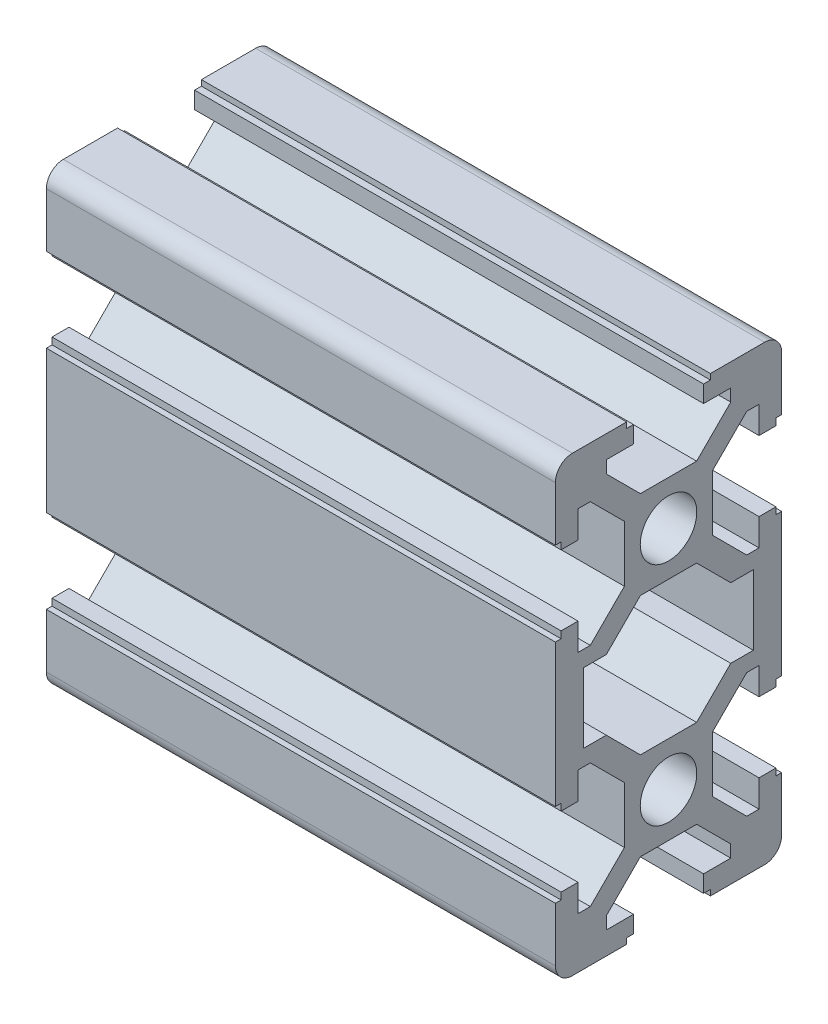
from build123d import *

# Parameters (mm, degrees)
SKETCH_1_W                = 1048
SKETCH_1_H                = 40
EXTRUDE_1_DEPTH           = 20
CUT_EXTRUDE_1_DEPTH       = 1049.239330799
CUT_EXTRUDE_2_REACH       = 1050.811
CUT_EXTRUDE_3_REACH       = 1050.239
CUT_EXTRUDE_3_END_RADIUS  = 5
SKETCH_4_W                = 0.605
SKETCH_4_H                = 0.5
CUT_EXTRUDE_4_DEPTH       = 1049.239330799
CUT_EXTRUDE_5_DEPTH       = 1049.737119623
CUT_EXTRUDE_6_REACH       = 1050.239
CUT_EXTRUDE_6_END_RADIUS  = 5
SKETCH_7_W                = 0.605
SKETCH_7_H                = 0.5
CUT_EXTRUDE_7_REACH       = 1050.811
CUT_EXTRUDE_8_REACH       = 1050.239
CUT_EXTRUDE_8_END_RADIUS  = 5
SKETCH_9_W                = 0.605
SKETCH_9_H                = 0.5
CUT_EXTRUDE_9_REACH       = 1050.239
CUT_EXTRUDE_9_END_RADIUS  = 5
SKETCH_10_W               = 0.605
SKETCH_10_H               = 0.5
CUT_EXTRUDE_10_DEPTH      = 1049.737119623
CUT_EXTRUDE_11_REACH      = 1050.239
CUT_EXTRUDE_11_END_RADIUS = 5
SKETCH_12_W               = 0.605
SKETCH_12_H               = 0.5
CUT_EXTRUDE_12_DEPTH      = 1049.239330799
CUT_EXTRUDE_13_DEPTH      = 1049.239330799
CUT_EXTRUDE_14_REACH      = 1050.239
CUT_EXTRUDE_14_END_RADIUS = 5
SKETCH_15_W               = 0.605
SKETCH_15_H               = 0.5
CUT_EXTRUDE_15_REACH      = 1050.239
CUT_EXTRUDE_15_END_RADIUS = 5
SKETCH_16_W               = 0.605
SKETCH_16_H               = 0.5
CUT_EXTRUDE_16_DEPTH      = 1049.239330799
CUT_EXTRUDE_17_DEPTH      = 1049.239330799
CUT_EXTRUDE_18_REACH      = 1050.239
CUT_EXTRUDE_18_END_RADIUS = 5
SKETCH_19_W               = 0.605
SKETCH_19_H               = 0.5
CUT_EXTRUDE_19_DEPTH      = 1049.239330799
DRAFT_1_ANGLE             = 45
DRAFT_2_ANGLE             = 45
SKETCH_21_W               = 5
SKETCH_21_H               = 5.49122085
SKETCH_22_W               = 5
SKETCH_22_H               = 5.49864809
HOLE_WIZARD_5_0_5_1_D     = 4.999999999
HOLE_WIZARD_5_0_5_2_D     = 4.999999999
FILLET_1_R                = 1.5
SKETCH_27_W               = 25
SKETCH_27_H               = 45
CUT_EXTRUDE_21_DEPTH      = 501.5
CUT_EXTRUDE_START         = -1048
SKETCH_28_W               = 25
SKETCH_28_H               = 45
CUT_EXTRUDE_22_DEPTH      = 501.5


with BuildPart() as part:
    # 草图1 → 凸台-拉伸1 (new body)
    with BuildSketch(Plane.XY.offset(9.92299271)):
        with Locations((-524, -0.00371362)):
            Rectangle(SKETCH_1_W, SKETCH_1_H)
    extrude(amount=-EXTRUDE_1_DEPTH)

    # 草图2 → 切除-拉伸1 (cut, through all)
    with BuildSketch(Plane(origin=(0, 0, 0), x_dir=(0, 0, -1), z_dir=(1, 0, 0))):
        Polygon((-3.02299271, 19.99628638), (-3.02299271, 17.99628638), (-5.42299271, 17.99628638), (-5.42299271, 16.91049994), (-2.40877915, 13.89628638), (2.56279373, 13.89628638), (5.57700729, 16.91049994), (5.57700729, 17.99628638), (3.17700729, 17.99628638), (3.17700729, 19.99628638), align=None)
    extrude(amount=-CUT_EXTRUDE_1_DEPTH, mode=Mode.SUBTRACT)

    # 草图3 → 切除-拉伸2 (cut, up to next)
    with BuildSketch(Plane(origin=(0, 19.99628638, 0), x_dir=(-1, 0, 0), z_dir=(0, 1, 0)), mode=Mode.PRIVATE) as cut_extrude_2_sk1:
        with BuildLine():
            Line((9.017348236, 3.02299271), (16.982651764, 3.02299271))
            ThreePointArc((16.982651764, 3.02299271), (13, 5), (9.017348236, 3.02299271))
        make_face()
    cut_extrude_2_tool1 = extrude(cut_extrude_2_sk1.sketch, amount=-CUT_EXTRUDE_2_REACH, mode=Mode.PRIVATE) & part.part
    add(cut_extrude_2_tool1.solids().sort_by_distance((-13, 19.996286, 3.828944))[0], mode=Mode.SUBTRACT)

    # 切除-拉伸3: up to this cylinder (the profile starts outside it)
    cut_extrude_3_end = Plane(origin=(-13, 19.746286, 0), z_dir=(0, 1, 0)) * Cylinder(CUT_EXTRUDE_3_END_RADIUS, 2111.478, mode=Mode.PRIVATE)
    # 草图4 → 切除-拉伸3 (cut, up to the surface)
    with BuildSketch(Plane.ZY.offset(1048), mode=Mode.PRIVATE) as cut_extrude_3_sk1:
        with Locations((3.32549271, 19.74628638)):
            Rectangle(SKETCH_4_W, SKETCH_4_H)
    cut_extrude_3_tool1 = extrude(cut_extrude_3_sk1.sketch, amount=-CUT_EXTRUDE_3_REACH, mode=Mode.PRIVATE) - cut_extrude_3_end
    add(cut_extrude_3_tool1.solids().sort_by_distance((-1048, 19.746286, 3.325493))[0], mode=Mode.SUBTRACT)

    # 草图5 → 切除-拉伸4 (cut, through all)
    with BuildSketch(Plane(origin=(0, 0, 0), x_dir=(0, 0, -1), z_dir=(1, 0, 0))):
        Polygon((-3.02299271, -20.00371362), (3.17700729, -20.00371362), (3.17700729, -18.00371362), (5.57700729, -18.00371362), (5.57700729, -16.91792718), (2.56279373, -13.90371362), (-2.40877915, -13.90371362), (-5.42299271, -16.91792718), (-5.42299271, -18.00371362), (-3.02299271, -18.00371362), align=None)
    extrude(amount=-CUT_EXTRUDE_4_DEPTH, mode=Mode.SUBTRACT)

    # 草图6 → 切除-拉伸5 (cut, through all)
    with BuildSketch(Plane(origin=(0, -18.00371362, 0), x_dir=(-1, 0, 0), z_dir=(0, 1, 0))):
        with BuildLine():
            Line((9.017348236, 3.02299271), (16.982651764, 3.02299271))
            ThreePointArc((16.982651764, 3.02299271), (13, 5), (9.017348236, 3.02299271))
        make_face()
    extrude(amount=-CUT_EXTRUDE_5_DEPTH, mode=Mode.SUBTRACT)

    # 切除-拉伸6: up to this cylinder (the profile starts outside it)
    cut_extrude_6_end = Plane(origin=(-13, -19.753714, 0), z_dir=(0, 1, 0)) * Cylinder(CUT_EXTRUDE_6_END_RADIUS, 2111.478, mode=Mode.PRIVATE)
    # 草图7 → 切除-拉伸6 (cut, up to the surface)
    with BuildSketch(Plane.ZY.offset(1048), mode=Mode.PRIVATE) as cut_extrude_6_sk1:
        with Locations((3.32549271, -19.75371362)):
            Rectangle(SKETCH_7_W, SKETCH_7_H)
    cut_extrude_6_tool1 = extrude(cut_extrude_6_sk1.sketch, amount=-CUT_EXTRUDE_6_REACH, mode=Mode.PRIVATE) - cut_extrude_6_end
    add(cut_extrude_6_tool1.solids().sort_by_distance((-1048, -19.753714, 3.325493))[0], mode=Mode.SUBTRACT)

    # 草图8 → 切除-拉伸7 (cut, up to next)
    with BuildSketch(Plane.XZ.offset(20.00371362), mode=Mode.PRIVATE) as cut_extrude_7_sk1:
        with BuildLine():
            Line((-9.139090175, -3.17700729), (-16.860909825, -3.17700729))
            ThreePointArc((-16.860909825, -3.17700729), (-13, -5), (-9.139090175, -3.17700729))
        make_face()
    cut_extrude_7_tool1 = extrude(cut_extrude_7_sk1.sketch, amount=-CUT_EXTRUDE_7_REACH, mode=Mode.PRIVATE) & part.part
    add(cut_extrude_7_tool1.solids().sort_by_distance((-13, -20.003714, -3.918953))[0], mode=Mode.SUBTRACT)

    # 切除-拉伸8: up to this cylinder (the profile starts outside it)
    cut_extrude_8_end = Plane(origin=(-13, -19.753714, 0), z_dir=(0, -1, 0)) * Cylinder(CUT_EXTRUDE_8_END_RADIUS, 2111.478, mode=Mode.PRIVATE)
    # 草图9 → 切除-拉伸8 (cut, up to the surface)
    with BuildSketch(Plane.ZY.offset(1048), mode=Mode.PRIVATE) as cut_extrude_8_sk1:
        with Locations((-3.47950729, -19.75371362)):
            Rectangle(SKETCH_9_W, SKETCH_9_H)
    cut_extrude_8_tool1 = extrude(cut_extrude_8_sk1.sketch, amount=-CUT_EXTRUDE_8_REACH, mode=Mode.PRIVATE) - cut_extrude_8_end
    add(cut_extrude_8_tool1.solids().sort_by_distance((-1048, -19.753714, -3.479507))[0], mode=Mode.SUBTRACT)

    # 切除-拉伸9: up to this cylinder (the profile starts outside it)
    cut_extrude_9_end = Plane(origin=(-13, 19.746286, 0), z_dir=(0, 1, 0)) * Cylinder(CUT_EXTRUDE_9_END_RADIUS, 2111.478, mode=Mode.PRIVATE)
    # 草图10 → 切除-拉伸9 (cut, up to the surface)
    with BuildSketch(Plane(origin=(0, 0, 0), x_dir=(0, 0, -1), z_dir=(1, 0, 0)), mode=Mode.PRIVATE) as cut_extrude_9_sk1:
        with Locations((-3.32549271, 19.74628638)):
            Rectangle(SKETCH_10_W, SKETCH_10_H)
    cut_extrude_9_tool1 = extrude(cut_extrude_9_sk1.sketch, amount=-CUT_EXTRUDE_9_REACH, mode=Mode.PRIVATE) - cut_extrude_9_end
    add(cut_extrude_9_tool1.solids().sort_by_distance((0, 19.746286, 3.325493))[0], mode=Mode.SUBTRACT)

    # 草图11 → 切除-拉伸10 (cut, through all)
    with BuildSketch(Plane.XZ.offset(-17.99628638)):
        with BuildLine():
            Line((-9.139090175, -3.17700729), (-16.860909825, -3.17700729))
            ThreePointArc((-16.860909825, -3.17700729), (-13, -5), (-9.139090175, -3.17700729))
        make_face()
    extrude(amount=-CUT_EXTRUDE_10_DEPTH, mode=Mode.SUBTRACT)

    # 切除-拉伸11: up to this cylinder (the profile starts outside it)
    cut_extrude_11_end = Plane(origin=(-13, 19.746286, 0), z_dir=(0, -1, 0)) * Cylinder(CUT_EXTRUDE_11_END_RADIUS, 2111.478, mode=Mode.PRIVATE)
    # 草图12 → 切除-拉伸11 (cut, up to the surface)
    with BuildSketch(Plane(origin=(0, 0, 0), x_dir=(0, 0, -1), z_dir=(1, 0, 0)), mode=Mode.PRIVATE) as cut_extrude_11_sk1:
        with Locations((3.47950729, 19.74628638)):
            Rectangle(SKETCH_12_W, SKETCH_12_H)
    cut_extrude_11_tool1 = extrude(cut_extrude_11_sk1.sketch, amount=-CUT_EXTRUDE_11_REACH, mode=Mode.PRIVATE) - cut_extrude_11_end
    add(cut_extrude_11_tool1.solids().sort_by_distance((0, 19.746286, -3.479507))[0], mode=Mode.SUBTRACT)

    # 草图13 → 切除-拉伸12 (cut, through all)
    with BuildSketch(Plane(origin=(0, 0, 0), x_dir=(0, 0, -1), z_dir=(1, 0, 0))):
        Polygon((10.07700729, 13.70128638), (9.57700729, 13.70128638), (9.57700729, 13.09628638), (8.07700729, 13.09628638), (8.07700729, 15.49628638), (6.99122085, 15.49628638), (3.97700729, 12.48207282), (3.97700729, 7.51049994), (6.99122085, 4.49628638), (8.07700729, 4.49628638), (8.07700729, 6.89628638), (9.57700729, 6.89628638), (9.57700729, 6.29128638), (10.07700729, 6.29128638), align=None)
    extrude(amount=-CUT_EXTRUDE_12_DEPTH, mode=Mode.SUBTRACT)

    # 草图14 → 切除-拉伸13 (cut, through all)
    with BuildSketch(Plane(origin=(0, 0, 0), x_dir=(0, 0, -1), z_dir=(1, 0, 0))):
        Polygon((10.07700729, -6.29871362), (9.57700729, -6.29871362), (9.57700729, -6.90371362), (8.07700729, -6.90371362), (8.07700729, -4.50371362), (6.99122085, -4.50371362), (3.97700729, -7.51792718), (3.97700729, -12.48950006), (6.99122085, -15.50371362), (8.07700729, -15.50371362), (8.07700729, -13.10371362), (9.57700729, -13.10371362), (9.57700729, -13.70871362), (10.07700729, -13.70871362), align=None)
    extrude(amount=-CUT_EXTRUDE_13_DEPTH, mode=Mode.SUBTRACT)

    # 切除-拉伸14: up to this cylinder (the profile starts outside it)
    cut_extrude_14_end = Plane(origin=(-13, -19.753714, 0), z_dir=(0, -1, 0)) * Cylinder(CUT_EXTRUDE_14_END_RADIUS, 2111.478, mode=Mode.PRIVATE)
    # 草图15 → 切除-拉伸14 (cut, up to the surface)
    with BuildSketch(Plane(origin=(0, 0, 0), x_dir=(0, 0, -1), z_dir=(1, 0, 0)), mode=Mode.PRIVATE) as cut_extrude_14_sk1:
        with Locations((3.47950729, -19.75371362)):
            Rectangle(SKETCH_15_W, SKETCH_15_H)
    cut_extrude_14_tool1 = extrude(cut_extrude_14_sk1.sketch, amount=-CUT_EXTRUDE_14_REACH, mode=Mode.PRIVATE) - cut_extrude_14_end
    add(cut_extrude_14_tool1.solids().sort_by_distance((0, -19.753714, -3.479507))[0], mode=Mode.SUBTRACT)

    # 切除-拉伸15: up to this cylinder (the profile starts outside it)
    cut_extrude_15_end = Plane(origin=(-13, -19.753714, 0), z_dir=(0, 1, 0)) * Cylinder(CUT_EXTRUDE_15_END_RADIUS, 2111.478, mode=Mode.PRIVATE)
    # 草图16 → 切除-拉伸15 (cut, up to the surface)
    with BuildSketch(Plane(origin=(0, 0, 0), x_dir=(0, 0, -1), z_dir=(1, 0, 0)), mode=Mode.PRIVATE) as cut_extrude_15_sk1:
        with Locations((-3.32549271, -19.75371362)):
            Rectangle(SKETCH_16_W, SKETCH_16_H)
    cut_extrude_15_tool1 = extrude(cut_extrude_15_sk1.sketch, amount=-CUT_EXTRUDE_15_REACH, mode=Mode.PRIVATE) - cut_extrude_15_end
    add(cut_extrude_15_tool1.solids().sort_by_distance((0, -19.753714, 3.325493))[0], mode=Mode.SUBTRACT)

    # 草图17 → 切除-拉伸16 (cut, through all)
    with BuildSketch(Plane(origin=(0, 0, 0), x_dir=(0, 0, -1), z_dir=(1, 0, 0))):
        Polygon((-9.92299271, -13.70871362), (-9.42299271, -13.70871362), (-9.42299271, -13.10371362), (-7.92299271, -13.10371362), (-7.92299271, -15.50371362), (-6.83720627, -15.50371362), (-3.82299271, -12.48950006), (-3.82299271, -7.51792718), (-6.83720627, -4.50371362), (-7.92299271, -4.50371362), (-7.92299271, -6.90371362), (-9.42299271, -6.90371362), (-9.42299271, -6.29871362), (-9.92299271, -6.29871362), align=None)
    extrude(amount=-CUT_EXTRUDE_16_DEPTH, mode=Mode.SUBTRACT)

    # 草图18 → 切除-拉伸17 (cut, through all)
    with BuildSketch(Plane(origin=(0, 0, 0), x_dir=(0, 0, -1), z_dir=(1, 0, 0))):
        Polygon((-9.92299271, 6.29128638), (-9.42299271, 6.29128638), (-9.42299271, 6.89628638), (-7.92299271, 6.89628638), (-7.92299271, 4.49628638), (-6.83720627, 4.49628638), (-3.82299271, 7.51049994), (-3.82299271, 12.48207282), (-6.83720627, 15.49628638), (-7.92299271, 15.49628638), (-7.92299271, 13.09628638), (-9.42299271, 13.09628638), (-9.42299271, 13.70128638), (-9.92299271, 13.70128638), align=None)
    extrude(amount=-CUT_EXTRUDE_17_DEPTH, mode=Mode.SUBTRACT)

    # 切除-拉伸18: up to this cylinder (the profile starts outside it)
    cut_extrude_18_end = Plane(origin=(-13, 19.746286, 0), z_dir=(0, -1, 0)) * Cylinder(CUT_EXTRUDE_18_END_RADIUS, 2111.478, mode=Mode.PRIVATE)
    # 草图19 → 切除-拉伸18 (cut, up to the surface)
    with BuildSketch(Plane.ZY.offset(1048), mode=Mode.PRIVATE) as cut_extrude_18_sk1:
        with Locations((-3.47950729, 19.74628638)):
            Rectangle(SKETCH_19_W, SKETCH_19_H)
    cut_extrude_18_tool1 = extrude(cut_extrude_18_sk1.sketch, amount=-CUT_EXTRUDE_18_REACH, mode=Mode.PRIVATE) - cut_extrude_18_end
    add(cut_extrude_18_tool1.solids().sort_by_distance((-1048, 19.746286, -3.479507))[0], mode=Mode.SUBTRACT)

    # 草图20 → 切除-拉伸19 (cut, through all)
    with BuildSketch(Plane.ZY.offset(1048)):
        Polygon((2.40877915, -3.08950006), (7.42299271, -3.08950006), (7.42299271, 3.08207282), (2.40877915, 3.08207282), (2.40877915, 6.09628638), (-2.56279373, 6.09628638), (-2.56279373, 3.08207282), (-7.57700729, 3.08207282), (-7.57700729, -3.08950006), (-2.56279373, -3.08950006), (-2.56279373, -6.10371362), (2.40877915, -6.10371362), align=None)
    extrude(amount=-CUT_EXTRUDE_19_DEPTH, mode=Mode.SUBTRACT)

    # 拔模1
    draft_1_faces = [part.faces().sort_by_distance(p)[0] for p in [
        (-524, -4.59660684, 2.40877915),
        (-524, -4.59660684, -2.56279373),
    ]]
    draft(draft_1_faces, Plane(origin=(0, -6.10371362, -2.56279373), x_dir=(0, 0, 1), z_dir=(0, 1, 0)), DRAFT_1_ANGLE)

    # 拔模2
    draft_2_faces = [part.faces().sort_by_distance(p)[0] for p in [
        (-524, 4.5891796, -2.56279373),
        (-524, 4.5891796, 2.40877915),
    ]]
    draft(draft_2_faces, Plane(origin=(0, 6.09628638, 2.40877915), x_dir=(0, 0, -1), z_dir=(0, -1, 0)), DRAFT_2_ANGLE)

    # 草图21 → 切除-旋转1 (revolve, cut)
    with BuildSketch(Plane(origin=(0, 0, 0), x_dir=(-1, 0, 0), z_dir=(0, 0, -1)), mode=Mode.PRIVATE) as cut_revolve_1_sk:
        with Locations((10.5, 13.741896805)):
            Rectangle(SKETCH_21_W, SKETCH_21_H)
    revolve(cut_revolve_1_sk.sketch.rotate(Axis((-13, 10.99628638, 0), (0, 1, 0)), 229.871289748), axis=Axis((-13, 10.99628638, 0), (0, 1, 0)), mode=Mode.SUBTRACT)

    # 草图22 → 切除-旋转2 (revolve, cut)
    with BuildSketch(Plane.XY, mode=Mode.PRIVATE) as cut_revolve_2_sk:
        with Locations((-10.5, -13.745610425)):
            Rectangle(SKETCH_22_W, SKETCH_22_H)
    revolve(cut_revolve_2_sk.sketch.rotate(Axis((-13, -10.99628638, 0), (0, -1, 0)), 232.693190821), axis=Axis((-13, -10.99628638, 0), (0, -1, 0)), mode=Mode.SUBTRACT)

    # Ø5.0 (5) 直径孔1 (through all)
    with Locations(Plane(origin=(0, 0, 0), x_dir=(0, 0, -1), z_dir=(1, 0, 0))):
        with Locations((0.07700729, 9.99628638)):
            Hole(HOLE_WIZARD_5_0_5_1_D / 2)

    # Ø5.0 (5) 直径孔2 (through all)
    with Locations(Plane.ZY.offset(1048)):
        with Locations((-0.07700729, -10.00371362)):
            Hole(HOLE_WIZARD_5_0_5_2_D / 2)

    # 圆角1
    fillet_1_edges = [part.edges().sort_by_distance(p)[0] for p in [
        (-524, -20.00371362, -10.07700729),
        (-524, 19.99628638, -10.07700729),
        (-524, -20.00371362, 9.92299271),
        (-524, 19.99628638, 9.92299271),
    ]]
    fillet(fillet_1_edges, radius=FILLET_1_R)

    # 草图27 → 切除-拉伸21 (cut)
    with BuildSketch(Plane(origin=(0, 0, 0), x_dir=(0, 0, -1), z_dir=(1, 0, 0))):
        Rectangle(SKETCH_27_W, SKETCH_27_H)
    extrude(amount=-CUT_EXTRUDE_21_DEPTH, mode=Mode.SUBTRACT)

    # 草图28 → 切除-拉伸22 (cut)
    with BuildSketch(Plane(origin=(0, 0, 0), x_dir=(0, 0, -1), z_dir=(1, 0, 0)).offset(CUT_EXTRUDE_START)):
        Rectangle(SKETCH_28_W, SKETCH_28_H)
    extrude(amount=CUT_EXTRUDE_22_DEPTH, mode=Mode.SUBTRACT)


solid = part.part
